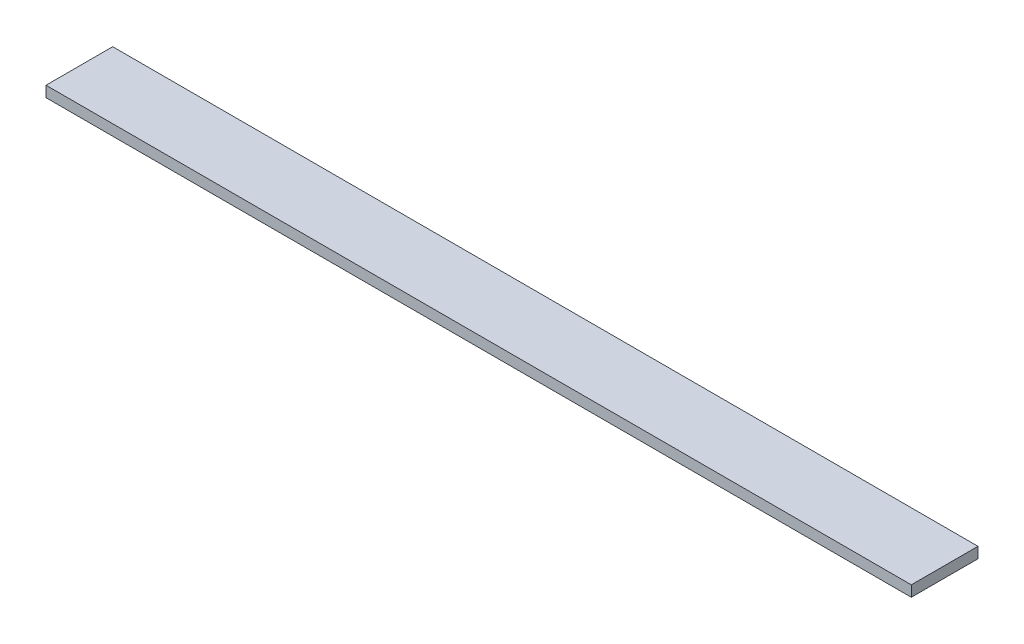
from build123d import *

# Parameters (mm, degrees)
SKETCH1_W           = 3048
SKETCH1_H           = 234.95
BOSS_EXTRUDE1_DEPTH = 38.1


with BuildPart() as part:
    # Sketch1 → Boss-Extrude1 (new body)
    with BuildSketch(Plane(origin=(0, 0, 0), x_dir=(1, 0, 0), z_dir=(0, 1, 0))):
        with Locations((211.744058501, 462.035054845)):
            Rectangle(SKETCH1_W, SKETCH1_H)
    extrude(amount=BOSS_EXTRUDE1_DEPTH)


solid = part.part
